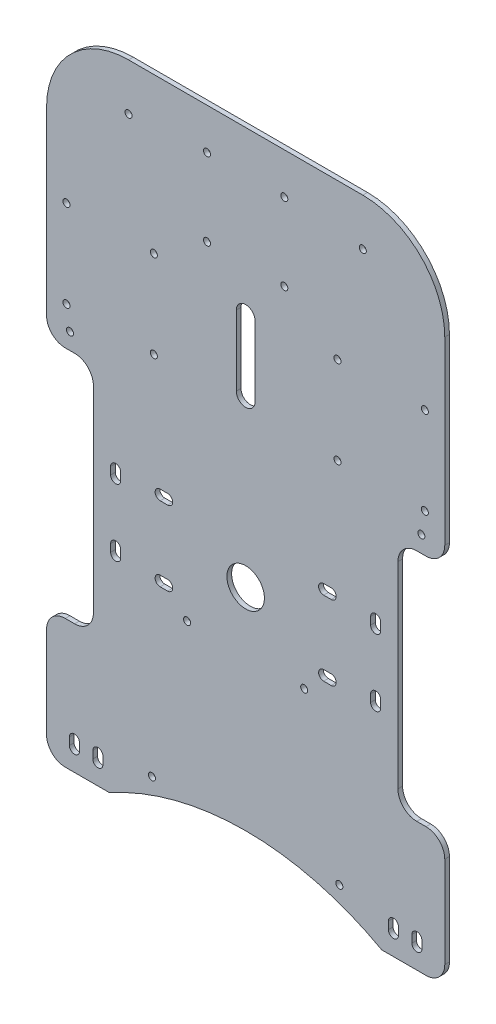
from build123d import *

# Parameters (mm, degrees)
SKETCH1_R           = 8
BOSS_EXTRUDE1_DEPTH = 2
FILLET3_R           = 35
FILLET4_R           = 8
FILLET5_R           = 8
SKETCH6_R           = 1.5
CUT_EXTRUDE1_DEPTH  = 2
CUT_EXTRUDE2_DEPTH  = 10
CUT_EXTRUDE3_DEPTH  = 10
SKETCH10_R          = 1.5
CUT_EXTRUDE4_DEPTH  = 10
SKETCH11_R          = 1.5
CUT_EXTRUDE5_DEPTH  = 10
SKETCH12_R          = 1.5
CUT_EXTRUDE6_DEPTH  = 20


with BuildPart() as part:
    # Sketch1 → Boss-Extrude1 (new body)
    with BuildSketch(Plane.XY):
        with BuildLine():
            Line((85, 170), (-85, 170))
            Line((-85, 170), (-85, 50))
            Line((-85, 50), (-65, 50))
            Line((-65, 50), (-65, -50))
            Line((-65, -50), (-85, -50))
            Line((-85, -50), (-85, -105))
            Line((-85, -105), (-58.094750193, -105))
            ThreePointArc((-58.094750193, -105), (0, -90), (58.094750193, -105))
            Line((58.094750193, -105), (85, -105))
            Line((85, -105), (85, -50))
            Line((85, -50), (65, -50))
            Line((65, -50), (65, 50))
            Line((65, 50), (85, 50))
            Line((85, 50), (85, 170))
        make_face()
        Circle(SKETCH1_R, mode=Mode.SUBTRACT)
    extrude(amount=BOSS_EXTRUDE1_DEPTH)

    # Fillet3
    fillet3_edges = [part.edges().sort_by_distance(p)[0] for p in [
        (-85, 170, 1),
        (85, 170, 1),
    ]]
    fillet(fillet3_edges, radius=FILLET3_R)

    # Fillet4
    fillet4_edges = [part.edges().sort_by_distance(p)[0] for p in [
        (-85, -105, 1),
        (-85, -50, 1),
        (-65, -50, 1),
        (-65, 50, 1),
        (-85, 50, 1),
    ]]
    fillet(fillet4_edges, radius=FILLET4_R)

    # Fillet5
    fillet5_edges = [part.edges().sort_by_distance(p)[0] for p in [
        (85, 50, 1),
        (65, 50, 1),
        (65, -50, 1),
        (85, -50, 1),
        (85, -105, 1),
    ]]
    fillet(fillet5_edges, radius=FILLET5_R)

    # Sketch6 → Cut-Extrude1 (cut)
    with BuildSketch(Plane.XY.offset(2)):
        with Locations((-76.5, 66.5)):
            Circle(SKETCH6_R)
        with Locations((-76.5, 103.8)):
            Circle(SKETCH6_R)
        with Locations((-39.2, 103.8)):
            Circle(SKETCH6_R)
        with Locations((-39.2, 66.5)):
            Circle(SKETCH6_R)
        with Locations(Location((76.5, 66.5, 0), (0, 0, 180))):
            Circle(SKETCH6_R)
        with Locations(Location((76.5, 103.8, 0), (0, 0, 180))):
            Circle(SKETCH6_R)
        with Locations(Location((39.2, 103.8, 0), (0, 0, 180))):
            Circle(SKETCH6_R)
        with Locations(Location((39.2, 66.5, 0), (0, 0, 180))):
            Circle(SKETCH6_R)
    extrude(amount=-CUT_EXTRUDE1_DEPTH, mode=Mode.SUBTRACT)

    # Sketch8 → Cut-Extrude2 (cut)
    with BuildSketch(Plane(origin=(0, 0, 0), x_dir=(-1, 0, 0), z_dir=(0, 0, -1))):
        with BuildLine():
            Line((-4, 70.525433242), (-4, 100.525433242))
            ThreePointArc((-4, 100.525433242), (0, 104.525433242), (4, 100.525433242))
            Line((4, 100.525433242), (4, 70.525433242))
            ThreePointArc((4, 70.525433242), (0, 66.525433242), (-4, 70.525433242))
        make_face()
        with BuildLine():
            Line((-53.35, 15.9), (-53.35, 12.7))
            ThreePointArc((-53.35, 12.7), (-55.5, 10.55), (-57.65, 12.7))
            Line((-57.65, 12.7), (-57.65, 15.9))
            ThreePointArc((-57.65, 15.9), (-55.5, 18.05), (-53.35, 15.9))
        make_face()
        with BuildLine():
            Line((-53.35, -15.9), (-53.35, -12.7))
            ThreePointArc((-53.35, -12.7), (-55.5, -10.55), (-57.65, -12.7))
            Line((-57.65, -12.7), (-57.65, -15.9))
            ThreePointArc((-57.65, -15.9), (-55.5, -18.05), (-53.35, -15.9))
        make_face()
        with BuildLine():
            Line((-33.3, 13.75), (-36.5, 13.75))
            ThreePointArc((-36.5, 13.75), (-38.65, 15.9), (-36.5, 18.05))
            Line((-36.5, 18.05), (-33.3, 18.05))
            ThreePointArc((-33.3, 18.05), (-31.15, 15.9), (-33.3, 13.75))
        make_face()
        with BuildLine():
            Line((-33.3, -13.75), (-36.5, -13.75))
            ThreePointArc((-36.5, -13.75), (-38.65, -15.9), (-36.5, -18.05))
            Line((-36.5, -18.05), (-33.3, -18.05))
            ThreePointArc((-33.3, -18.05), (-31.15, -15.9), (-33.3, -13.75))
        make_face()
        with BuildLine():
            Line((33.3, -13.75), (36.5, -13.75))
            ThreePointArc((36.5, -13.75), (38.65, -15.9), (36.5, -18.05))
            Line((36.5, -18.05), (33.3, -18.05))
            ThreePointArc((33.3, -18.05), (31.15, -15.9), (33.3, -13.75))
        make_face()
        with BuildLine():
            Line((33.3, 13.75), (36.5, 13.75))
            ThreePointArc((36.5, 13.75), (38.65, 15.9), (36.5, 18.05))
            Line((36.5, 18.05), (33.3, 18.05))
            ThreePointArc((33.3, 18.05), (31.15, 15.9), (33.3, 13.75))
        make_face()
        with BuildLine():
            Line((53.35, 15.9), (53.35, 12.7))
            ThreePointArc((53.35, 12.7), (55.5, 10.55), (57.65, 12.7))
            Line((57.65, 12.7), (57.65, 15.9))
            ThreePointArc((57.65, 15.9), (55.5, 18.05), (53.35, 15.9))
        make_face()
        with BuildLine():
            Line((53.35, -15.9), (53.35, -12.7))
            ThreePointArc((53.35, -12.7), (55.5, -10.55), (57.65, -12.7))
            Line((57.65, -12.7), (57.65, -15.9))
            ThreePointArc((57.65, -15.9), (55.5, -18.05), (53.35, -15.9))
        make_face()
    extrude(amount=-CUT_EXTRUDE2_DEPTH, mode=Mode.SUBTRACT)

    # Sketch9 → Cut-Extrude3 (cut)
    with BuildSketch(Plane.XY.offset(2)):
        with BuildLine():
            Line((-70.944750193, -92.9), (-70.944750193, -96.1))
            ThreePointArc((-70.944750193, -96.1), (-73.094750193, -98.25), (-75.244750193, -96.1))
            Line((-75.244750193, -96.1), (-75.244750193, -92.9))
            ThreePointArc((-75.244750193, -92.9), (-73.094750193, -90.75), (-70.944750193, -92.9))
        make_face()
        with BuildLine():
            Line((-65.244750193, -92.9), (-65.244750193, -96.1))
            ThreePointArc((-65.244750193, -96.1), (-63.094750193, -98.25), (-60.944750193, -96.1))
            Line((-60.944750193, -96.1), (-60.944750193, -92.9))
            ThreePointArc((-60.944750193, -92.9), (-63.094750193, -90.75), (-65.244750193, -92.9))
        make_face()
        with BuildLine():
            Line((65.244750193, -92.9), (65.244750193, -96.1))
            ThreePointArc((65.244750193, -96.1), (63.094750193, -98.25), (60.944750193, -96.1))
            Line((60.944750193, -96.1), (60.944750193, -92.9))
            ThreePointArc((60.944750193, -92.9), (63.094750193, -90.75), (65.244750193, -92.9))
        make_face()
        with BuildLine():
            Line((70.944750193, -92.9), (70.944750193, -96.1))
            ThreePointArc((70.944750193, -96.1), (73.094750193, -98.25), (75.244750193, -96.1))
            Line((75.244750193, -96.1), (75.244750193, -92.9))
            ThreePointArc((75.244750193, -92.9), (73.094750193, -90.75), (70.944750193, -92.9))
        make_face()
    extrude(amount=-CUT_EXTRUDE3_DEPTH, mode=Mode.SUBTRACT)

    # Sketch10 → Cut-Extrude4 (cut)
    with BuildSketch(Plane.XY.offset(2)):
        with Locations((-50, 150)):
            Circle(SKETCH10_R)
        with Locations((50, 150)):
            Circle(SKETCH10_R)
        with Locations((-75, 57)):
            Circle(SKETCH10_R)
        with Locations((75, 57)):
            Circle(SKETCH10_R)
    extrude(amount=-CUT_EXTRUDE4_DEPTH, mode=Mode.SUBTRACT)

    # Sketch11 → Cut-Extrude5 (cut)
    with BuildSketch(Plane.XY.offset(2)):
        with Locations((-40, -90)):
            Circle(SKETCH11_R)
        with Locations((40, -90)):
            Circle(SKETCH11_R)
        with Locations((-25, -25)):
            Circle(SKETCH11_R)
        with Locations((25, -25)):
            Circle(SKETCH11_R)
    extrude(amount=-CUT_EXTRUDE5_DEPTH, mode=Mode.SUBTRACT)

    # Sketch12 → Cut-Extrude6 (cut)
    with BuildSketch(Plane.XY.offset(2)):
        with Locations((-16.5, 119.5)):
            Circle(SKETCH12_R)
        with Locations((-16.5, 152.5)):
            Circle(SKETCH12_R)
        with Locations((16.5, 119.5)):
            Circle(SKETCH12_R)
        with Locations((16.5, 152.5)):
            Circle(SKETCH12_R)
    extrude(amount=-CUT_EXTRUDE6_DEPTH, mode=Mode.SUBTRACT)


solid = part.part
